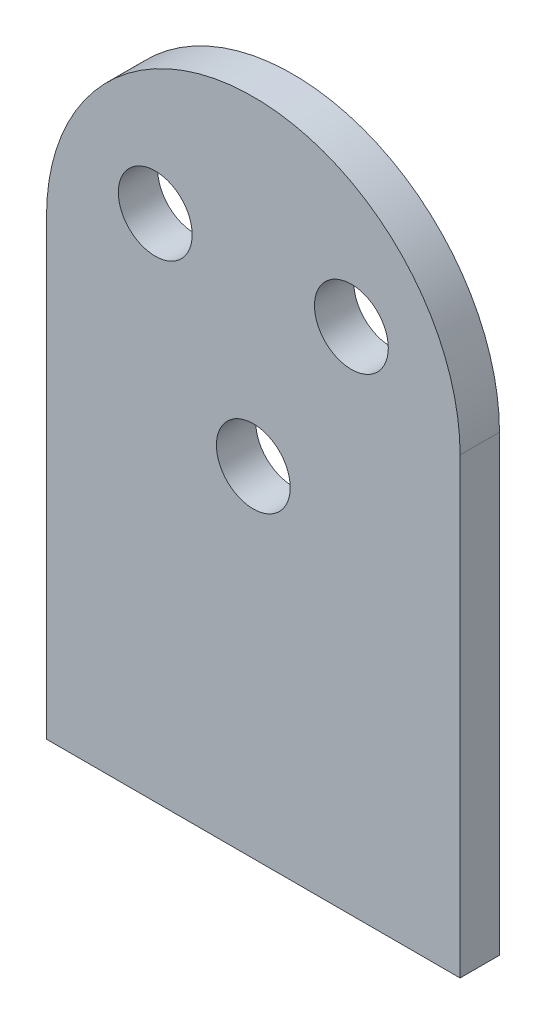
from build123d import *

# Parameters (mm, degrees)
SKETCH1_R           = 0.75
BOSS_EXTRUDE2_DEPTH = 0.8


with BuildPart() as part:
    # Sketch1 → Boss-Extrude2 (new body)
    with BuildSketch(Plane.XY):
        with BuildLine():
            Line((-4.2, 0), (-4.2, -9.2))
            Line((-4.2, -9.2), (4.2, -9.2))
            Line((4.2, -9.2), (4.2, 0))
            ThreePointArc((4.2, 0), (0, 4.2), (-4.2, 0))
        make_face()
        with Locations((0, -2.3)):
            Circle(SKETCH1_R, mode=Mode.SUBTRACT)
        with Locations((1.991858429, 1.15)):
            Circle(SKETCH1_R, mode=Mode.SUBTRACT)
        with Locations((-1.991858429, 1.15)):
            Circle(SKETCH1_R, mode=Mode.SUBTRACT)
    extrude(amount=BOSS_EXTRUDE2_DEPTH)


solid = part.part
